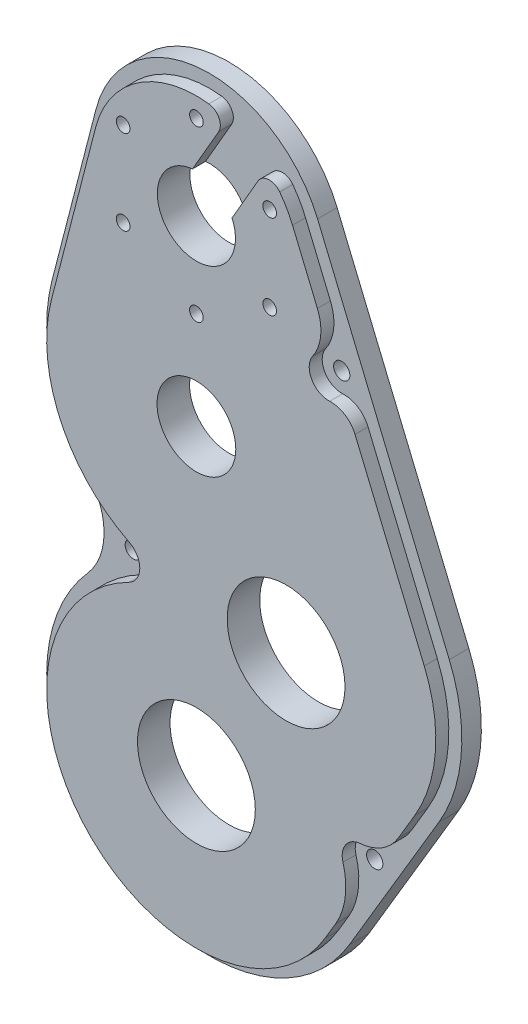
from build123d import *

# Parameters (mm, degrees)
SKETCH1_R           = 6
SKETCH1_R_2         = 6.05
SKETCH1_R_3         = 9.05
SKETCH1_R_4         = 1.05
BOSS_EXTRUDE1_DEPTH = 5
CUT_EXTRUDE1_START  = -2
CUT_EXTRUDE1_DEPTH  = 2
SKETCH3_R           = 1.25
CUT_EXTRUDE2_DEPTH  = 107.775662697


with BuildPart() as part:
    # Sketch1 → Boss-Extrude1 (new body)
    with BuildSketch(Plane.XY):
        with BuildLine():
            Line((-17.428425058, 4.5), (-24.206145914, -21.75))
            ThreePointArc((-24.206145914, -21.75), (-24.304944461, -33.854030643), (-18.705990528, -44.585714286))
            ThreePointArc((-18.705990528, -44.585714286), (-16.188386739, -51.22), (-18.705990528, -57.854285714))
            ThreePointArc((-18.705990528, -57.854285714), (-14.737892988, -94.633922608), (21.5, -87.197350822))
            Line((21.5, -87.197350822), (35.277938888, -63.977350822))
            ThreePointArc((35.277938888, -63.977350822), (38.71637128, -52.973450833), (36.851550967, -41.59667284))
            Line((36.851550967, -41.59667284), (16.613000697, 6.928795555))
            ThreePointArc((16.613000697, 6.928795555), (-1.281011782, 17.954359048), (-17.428425058, 4.5))
        make_face()
        Circle(SKETCH1_R, mode=Mode.SUBTRACT)
        with Locations((0, -28)):
            Circle(SKETCH1_R_2, mode=Mode.SUBTRACT)
        with Locations((13.777938888, -51.22)):
            Circle(SKETCH1_R_3, mode=Mode.SUBTRACT)
        with Locations((0, -74.44)):
            Circle(SKETCH1_R_3, mode=Mode.SUBTRACT)
        with Locations((0, 13)):
            Circle(SKETCH1_R_4, mode=Mode.SUBTRACT)
        with Locations((11.258330249, 6.5)):
            Circle(SKETCH1_R_4, mode=Mode.SUBTRACT)
        with Locations((11.258330249, -6.5)):
            Circle(SKETCH1_R_4, mode=Mode.SUBTRACT)
        with Locations((0, -13)):
            Circle(SKETCH1_R_4, mode=Mode.SUBTRACT)
        with Locations((-11.258330249, -6.5)):
            Circle(SKETCH1_R_4, mode=Mode.SUBTRACT)
        with Locations((-11.258330249, 6.5)):
            Circle(SKETCH1_R_4, mode=Mode.SUBTRACT)
    extrude(amount=BOSS_EXTRUDE1_DEPTH)

    # Sketch2 → Cut-Extrude1 (cut)
    with BuildSketch(Plane.XY.offset(5).offset(CUT_EXTRUDE1_START)):
        with BuildLine():
            Line((16.613000697, 6.928795555), (36.851550967, -41.59667284))
            ThreePointArc((36.851550967, -41.59667284), (38.71637128, -52.973450833), (35.277938888, -63.977350822))
            Line((35.277938888, -63.977350822), (21.5, -87.197350822))
            ThreePointArc((21.5, -87.197350822), (-14.737892988, -94.633922608), (-18.705990528, -57.854285714))
            ThreePointArc((-18.705990528, -57.854285714), (-16.188386739, -51.22), (-18.705990528, -44.585714286))
            ThreePointArc((-18.705990528, -44.585714286), (-24.304944461, -33.854030643), (-24.206145914, -21.75))
            Line((-24.206145914, -21.75), (-17.428425058, 4.5))
            ThreePointArc((-17.428425058, 4.5), (-1.281011782, 17.954359048), (16.613000697, 6.928795555))
        make_face()
        with BuildLine():
            Line((9.468285508, 9.39955156), (5.467787499, 2.470485754))
            ThreePointArc((5.467787499, 2.470485754), (3, 5.196152423), (-0.594390327, 5.970485754))
            Line((-0.594390327, 5.970485754), (3.406107682, 12.89955156))
            ThreePointArc((3.406107682, 12.89955156), (3.46289335, 14.794014563), (1.913207856, 15.885201783))
            ThreePointArc((1.913207856, 15.885201783), (-9.022746373, 13.213252737), (-15.491933385, 4))
            Line((-15.491933385, 4), (-22.269654241, -22.25))
            ThreePointArc((-22.269654241, -22.25), (-20.946970822, -37.498653241), (-10.347792006, -48.540769231))
            ThreePointArc((-10.347792006, -48.540769231), (-8.697504007, -51.22), (-10.347792006, -53.899230769))
            ThreePointArc((-10.347792006, -53.899230769), (-16.813726675, -90.133903125), (19.78, -86.176762756))
            Line((19.78, -86.176762756), (21.416047429, -83.419527323))
            ThreePointArc((21.416047429, -83.419527323), (22.868749584, -79.189380689), (22.517294907, -74.730573258))
            ThreePointArc((22.517294907, -74.730573258), (22.927957655, -72.188598464), (25.15802624, -70.901324657))
            ThreePointArc((25.15802624, -70.901324657), (28.527716294, -69.789192601), (31.009004018, -67.252490018))
            Line((31.009004018, -67.252490018), (33.557938888, -62.956762756))
            ThreePointArc((33.557938888, -62.956762756), (36.721296689, -52.833174766), (35.005662001, -42.366539013))
            Line((35.005662001, -42.366539013), (24.369440107, -16.864334436))
            ThreePointArc((24.369440107, -16.864334436), (22.811532345, -15.020784633), (20.47666212, -14.409120101))
            ThreePointArc((20.47666212, -14.409120101), (17.701744194, -12.866781789), (17.865596008, -9.696272437))
            ThreePointArc((17.865596008, -9.696272437), (19.084800596, -6.438585473), (18.585469893, -2.996252973))
            Line((18.585469893, -2.996252973), (14.76711173, 6.158929383))
            ThreePointArc((14.76711173, 6.158929383), (13.890682857, 7.940335621), (12.800384361, 9.599487498))
            ThreePointArc((12.800384361, 9.599487498), (11.080545761, 10.395960893), (9.468285508, 9.39955156))
        make_face(mode=Mode.SUBTRACT)
    extrude(amount=CUT_EXTRUDE1_DEPTH, mode=Mode.SUBTRACT)

    # Sketch3 → Cut-Extrude2 (cut, through all)
    with BuildSketch(Plane.XY.offset(3)):
        with Locations((20.325912078, -11.412910091)):
            Circle(SKETCH3_R)
        with Locations((-11.697504007, -51.22)):
            Circle(SKETCH3_R)
        with Locations((25.397635129, -73.891740611)):
            Circle(SKETCH3_R)
    extrude(amount=-CUT_EXTRUDE2_DEPTH, mode=Mode.SUBTRACT)


solid = part.part
